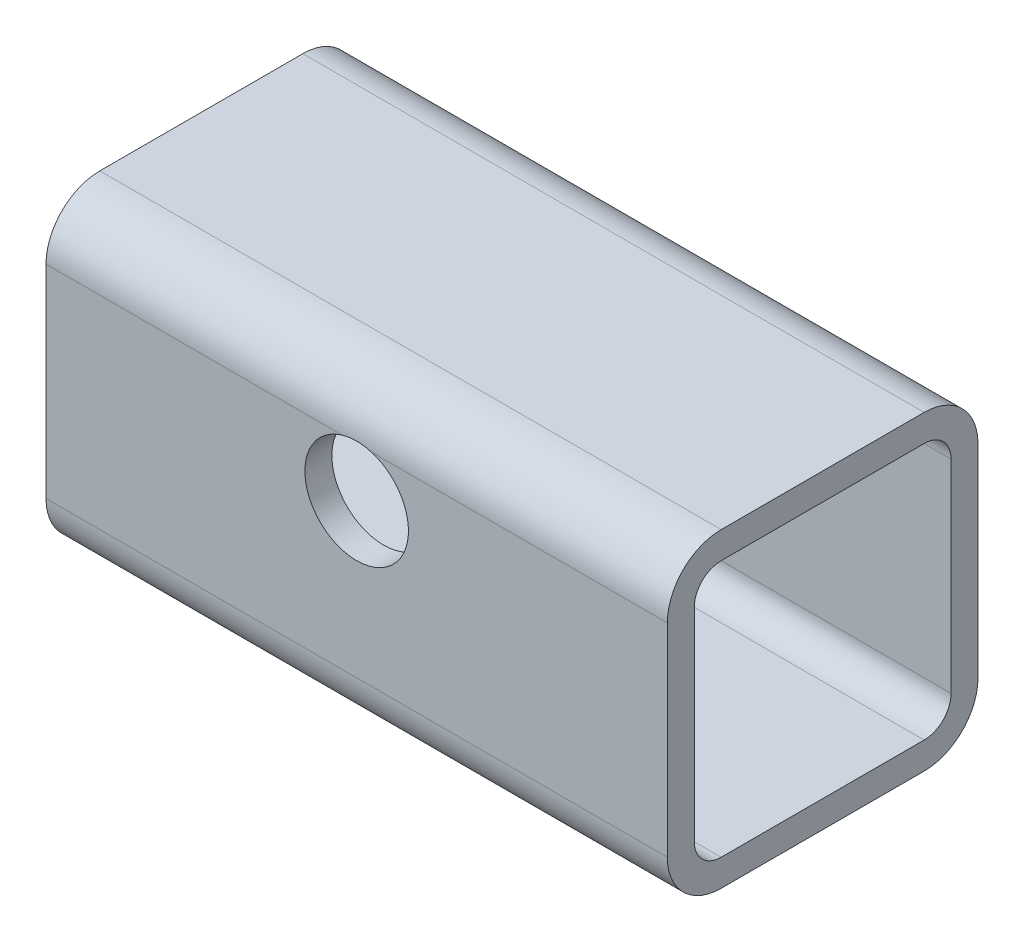
from build123d import *

# Parameters (mm, degrees)
RURA_KWADRATOWA_30_X_30_X_2_6_1_DEPTH = 60
SZKIC3_R                              = 5
WYTNIJ_WYCI_GNI_CIE1_DEPTH            = 69.738635424


with BuildPart() as part:
    # Sketch11 → Rura kwadratowa 30 X 30 X 2.6(1) (new body)
    with BuildSketch(Plane(origin=(0, 0, 0), x_dir=(0, 0, -1), z_dir=(1, 0, 0))):
        with BuildLine():
            Line((-9.8, -15), (9.8, -15))
            ThreePointArc((9.8, -15), (13.476955262, -13.476955262), (15, -9.8))
            Line((15, -9.8), (15, 9.8))
            ThreePointArc((15, 9.8), (13.476955262, 13.476955262), (9.8, 15))
            Line((9.8, 15), (-9.8, 15))
            ThreePointArc((-9.8, 15), (-13.476955262, 13.476955262), (-15, 9.8))
            Line((-15, 9.8), (-15, -9.8))
            ThreePointArc((-15, -9.8), (-13.476955262, -13.476955262), (-9.8, -15))
        make_face()
        with BuildLine():
            Line((-9.8, -12.4), (9.8, -12.4))
            ThreePointArc((9.8, -12.4), (11.638477631, -11.638477631), (12.4, -9.8))
            Line((12.4, -9.8), (12.4, 9.8))
            ThreePointArc((12.4, 9.8), (11.638477631, 11.638477631), (9.8, 12.4))
            Line((9.8, 12.4), (-9.8, 12.4))
            ThreePointArc((-9.8, 12.4), (-11.638477631, 11.638477631), (-12.4, 9.8))
            Line((-12.4, 9.8), (-12.4, -9.8))
            ThreePointArc((-12.4, -9.8), (-11.638477631, -11.638477631), (-9.8, -12.4))
        make_face(mode=Mode.SUBTRACT)
    extrude(amount=RURA_KWADRATOWA_30_X_30_X_2_6_1_DEPTH)

    # Szkic3 → Wytnij-wyciągnięcie1 (cut, through all)
    with BuildSketch(Plane.XY.offset(15)):
        with Locations(Location((30, 5, 0), (0, 0, 73.739795292))):
            Circle(SZKIC3_R)
    extrude(amount=-WYTNIJ_WYCI_GNI_CIE1_DEPTH, mode=Mode.SUBTRACT)


solid = part.part
